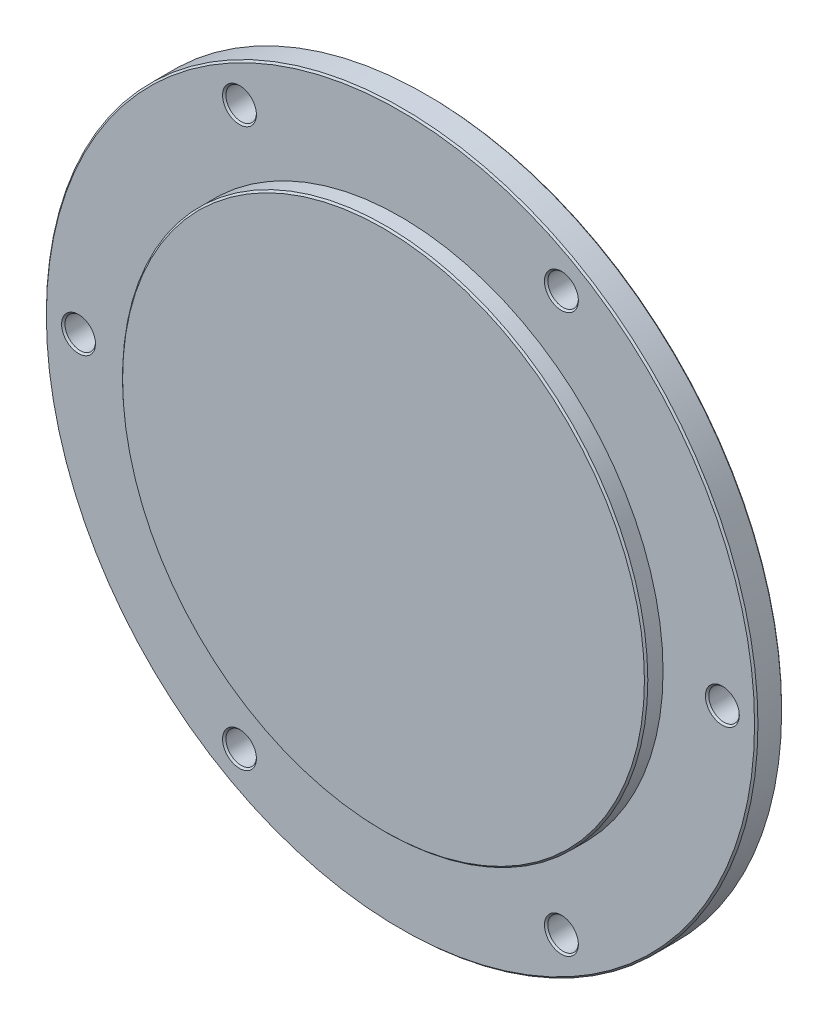
from build123d import *

# Parameters (mm, degrees)
HOLE1_D             = 9
HOLE2_D             = 9
SKETCH6_R           = 77.5
BOSS_EXTRUDE1_DEPTH = 5
CHAMFER1_SIZE       = 0.5


with BuildPart() as part:
    # Sketch1 → Revolve1 (revolve)
    with BuildSketch(Plane(origin=(0, 0, 0), x_dir=(1, 0, 0), z_dir=(0, 1, 0))):
        Polygon((105, 0), (0, 0), (0, -8), (104.5, -8), (105, -7.5), align=None)
    revolve(axis=Axis((0, 0, 0), (0, 0, 1)))

    # Hole1 (through all)
    with Locations(Plane.XY.offset(8)):
        with Locations((-47.5, -82.27241336), (-47.5, 82.27241336)):
            Hole(HOLE1_D / 2)

    # Hole2 (through all)
    with Locations(Plane(origin=(0, 0, 0), x_dir=(-1, 0, 0), z_dir=(0, 0, -1))):
        with Locations((-47.5, -82.27241336), (95, 0), (-47.5, 82.27241336), (-95, 0)):
            Hole(HOLE2_D / 2)

    # Sketch6 → Boss-Extrude1 (add)
    with BuildSketch(Plane.XY.offset(8)):
        Circle(SKETCH6_R)
    extrude(amount=BOSS_EXTRUDE1_DEPTH)

    # Chamfer1
    chamfer1_edges = [part.edges().sort_by_distance(p)[0] for p in [
        (-43, 82.27241336, 8),
        (-43, 82.27241336, 0),
        (-43, -82.27241336, 8),
        (-43, -82.27241336, 0),
        (90.5, 0, 0),
        (90.5, 0, 8),
        (43, 82.27241336, 0),
        (43, 82.27241336, 8),
        (-99.5, 0, 0),
        (-99.5, 0, 8),
        (43, -82.27241336, 0),
        (43, -82.27241336, 8),
        (-77.5, 0, 13),
        (-105, 0, 0),
    ]]
    chamfer(chamfer1_edges, length=CHAMFER1_SIZE)


solid = part.part
